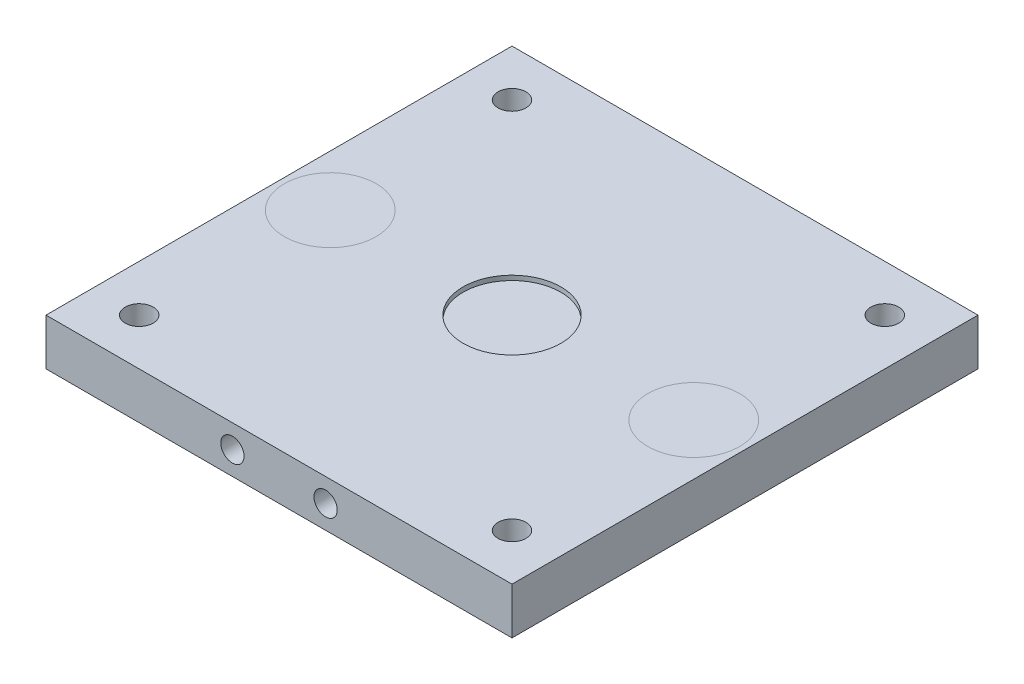
from build123d import *

# Parameters (mm, degrees)
SKETCH1_W           = 100
SKETCH1_H           = 100
BASE_DEPTH          = 10
SKETCH2_R           = 10.5
LOAD_CELL_CUT_DEPTH = 1
CUT_EXTRUDE1_REACH  = 73.414
SKETCH15_R          = 3
SKETCH21_R          = 2.5
CUT_EXTRUDE2_DEPTH  = 10


with BuildPart() as part:
    # Sketch1 → base (new body)
    with BuildSketch(Plane(origin=(0, 0, 0), x_dir=(1, 0, 0), z_dir=(0, 1, 0))):
        Rectangle(SKETCH1_W, SKETCH1_H)
    extrude(amount=BASE_DEPTH)

    # Sketch2 → load cell cut (cut)
    with BuildSketch(Plane(origin=(0, 10, 0), x_dir=(1, 0, 0), z_dir=(0, 1, 0))):
        with Locations(Location((0, 0, 0), (0, 0, 270))):
            Circle(SKETCH2_R)
    extrude(amount=-LOAD_CELL_CUT_DEPTH, mode=Mode.SUBTRACT)

    # Sketch15 → Cut-Extrude1 (cut, up to next)
    with BuildSketch(Plane(origin=(0, 0, 0), x_dir=(-1, 0, 0), z_dir=(0, -1, 0)), mode=Mode.PRIVATE) as cut_extrude1_sk1:
        with Locations(Location((40, -40, 0), (0, 0, 90))):
            Circle(SKETCH15_R)
    cut_extrude1_tool1 = extrude(cut_extrude1_sk1.sketch, amount=-CUT_EXTRUDE1_REACH, mode=Mode.PRIVATE) & part.part
    # Sketch15 → Cut-Extrude1 (cut, up to next)
    with BuildSketch(Plane(origin=(0, 0, 0), x_dir=(-1, 0, 0), z_dir=(0, -1, 0)), mode=Mode.PRIVATE) as cut_extrude1_sk2:
        with Locations(Location((-40, -40, 0), (0, 0, 90))):
            Circle(SKETCH15_R)
    cut_extrude1_tool2 = extrude(cut_extrude1_sk2.sketch, amount=-CUT_EXTRUDE1_REACH, mode=Mode.PRIVATE) & part.part
    # Sketch15 → Cut-Extrude1 (cut, up to next)
    with BuildSketch(Plane(origin=(0, 0, 0), x_dir=(-1, 0, 0), z_dir=(0, -1, 0)), mode=Mode.PRIVATE) as cut_extrude1_sk3:
        with Locations(Location((40, 40, 0), (0, 0, 90))):
            Circle(SKETCH15_R)
    cut_extrude1_tool3 = extrude(cut_extrude1_sk3.sketch, amount=-CUT_EXTRUDE1_REACH, mode=Mode.PRIVATE) & part.part
    # Sketch15 → Cut-Extrude1 (cut, up to next)
    with BuildSketch(Plane(origin=(0, 0, 0), x_dir=(-1, 0, 0), z_dir=(0, -1, 0)), mode=Mode.PRIVATE) as cut_extrude1_sk4:
        with Locations(Location((-40, 40, 0), (0, 0, 90))):
            Circle(SKETCH15_R)
    cut_extrude1_tool4 = extrude(cut_extrude1_sk4.sketch, amount=-CUT_EXTRUDE1_REACH, mode=Mode.PRIVATE) & part.part
    add(cut_extrude1_tool1.solids().sort_by_distance((-40, 0, 40))[0], mode=Mode.SUBTRACT)
    add(cut_extrude1_tool2.solids().sort_by_distance((40, 0, 40))[0], mode=Mode.SUBTRACT)
    add(cut_extrude1_tool3.solids().sort_by_distance((-40, 0, -40))[0], mode=Mode.SUBTRACT)
    add(cut_extrude1_tool4.solids().sort_by_distance((40, 0, -40))[0], mode=Mode.SUBTRACT)

    # Sketch21 → Cut-Extrude2 (cut)
    with BuildSketch(Plane(origin=(0, 0, -50), x_dir=(-1, 0, 0), z_dir=(0, 0, -1))):
        with Locations((-10, 5)):
            Circle(SKETCH21_R)
        with Locations((10, 5)):
            Circle(SKETCH21_R)
    cut_extrude2 = extrude(amount=-CUT_EXTRUDE2_DEPTH, mode=Mode.SUBTRACT)

    # Mirror2: Cut-Extrude2 across plane
    add(cut_extrude2.mirror(Plane.XY), mode=Mode.SUBTRACT)


solid = part.part
